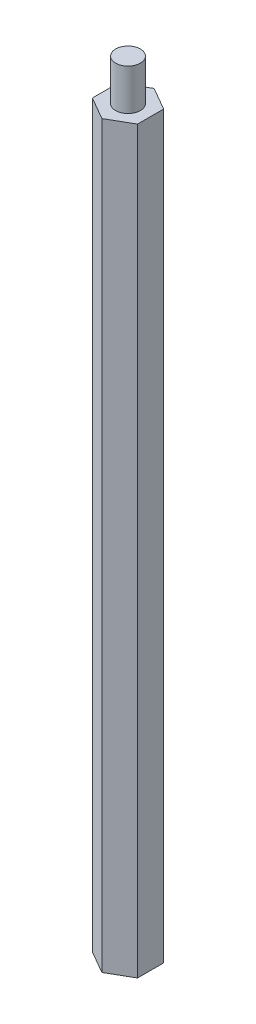
from build123d import *

# Parameters (mm, degrees)
BOSS_EXTRUDE1_DEPTH = 90
SKETCH2_R           = 1.5
BOSS_EXTRUDE2_DEPTH = 5


with BuildPart() as part:
    # Sketch1 → Boss-Extrude1 (new body)
    with BuildSketch(Plane(origin=(0, 0, 0), x_dir=(1, 0, 0), z_dir=(0, 1, 0))):
        Polygon((0, 3.175426481), (-2.75, 1.58771324), (-2.75, -1.58771324), (0, -3.175426481), (2.75, -1.58771324), (2.75, 1.58771324), align=None)
    extrude(amount=BOSS_EXTRUDE1_DEPTH)

    # Sketch2 → Boss-Extrude2 (add)
    with BuildSketch(Plane(origin=(0, 90, 0), x_dir=(1, 0, 0), z_dir=(0, 1, 0))):
        with Locations(Location((0, 0, 0), (0, 0, 270))):
            Circle(SKETCH2_R)
    extrude(amount=BOSS_EXTRUDE2_DEPTH)


solid = part.part
